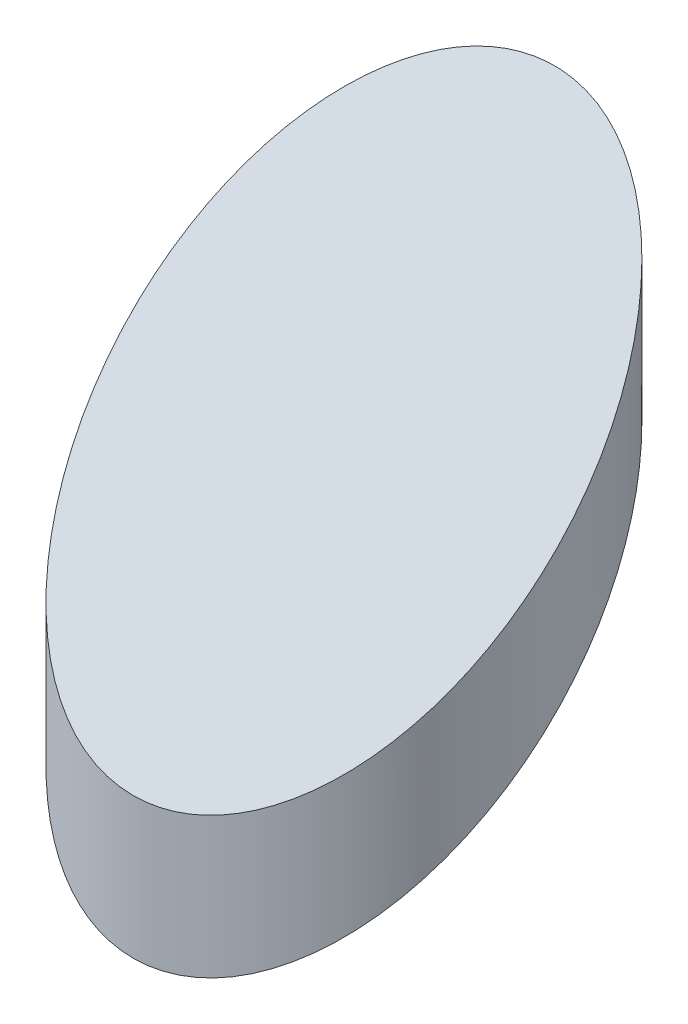
from build123d import *

# Parameters (mm, degrees)
SKETCH2_R               = 28.575
BOSS_EXTRUDE1_DEPTH     = 80
CUT_EXTRUDE2_DEPTH      = 90.627346552
CUT_EXTRUDE2_DEPTH_BACK = 90.627346552


with BuildPart() as part:
    # Sketch2 → Boss-Extrude1 (new body)
    with BuildSketch(Plane(origin=(0, 0, 0), x_dir=(1, 0, 0), z_dir=(0, 1, 0))):
        with Locations(Location((0, 0, 0), (0, 0, 270))):
            Circle(SKETCH2_R)
    extrude(amount=BOSS_EXTRUDE1_DEPTH)

    # Sketch3 → Cut-Extrude2 (cut, two sides: drawn at the far end of the back side and taken through both)
    with BuildSketch(Plane(origin=(0, 0, 0), x_dir=(0, 0, -1), z_dir=(1, 0, 0)).offset(-CUT_EXTRUDE2_DEPTH_BACK)):
        Polygon((28.575, 80), (-28.575, 80), (-28.575, 19.109985026), (28.575, 76.259985026), align=None)
        Polygon((28.575, 0), (28.575, 57.15), (-28.575, 0), align=None)
    extrude(amount=CUT_EXTRUDE2_DEPTH + CUT_EXTRUDE2_DEPTH_BACK, mode=Mode.SUBTRACT)


solid = part.part
